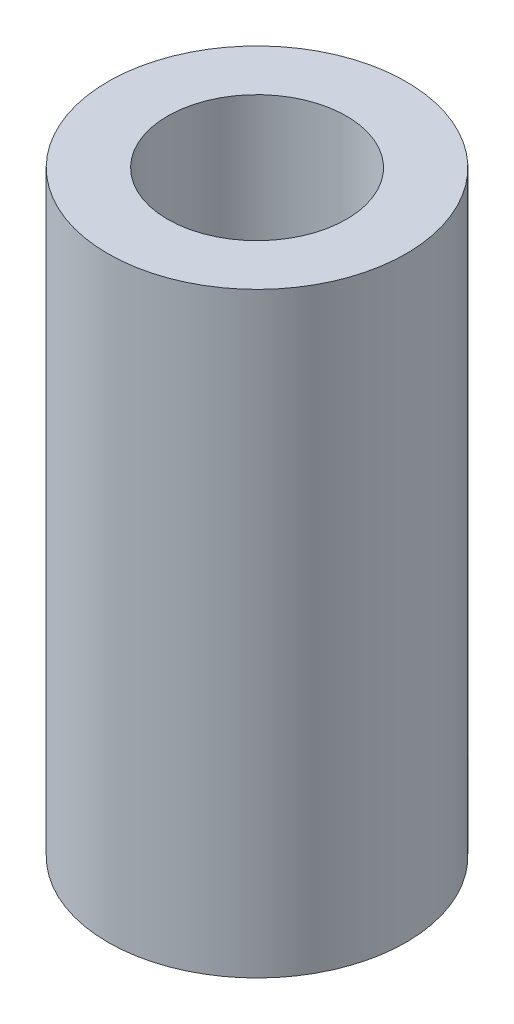
from build123d import *

# Parameters (mm, degrees)
ESQUISSE1_R        = 2.5
ESQUISSE1_R_2      = 1.5
BOSS_EXTRU_1_DEPTH = 10


with BuildPart() as part:
    # Esquisse1 → Boss.-Extru.1 (new body)
    with BuildSketch(Plane(origin=(0, 0, 0), x_dir=(1, 0, 0), z_dir=(0, 1, 0))):
        with Locations(Location((0, 0, 0), (0, 0, 270))):
            Circle(ESQUISSE1_R)
        with Locations(Location((0, 0, 0), (0, 0, 270))):
            Circle(ESQUISSE1_R_2, mode=Mode.SUBTRACT)
    extrude(amount=BOSS_EXTRU_1_DEPTH)


solid = part.part
